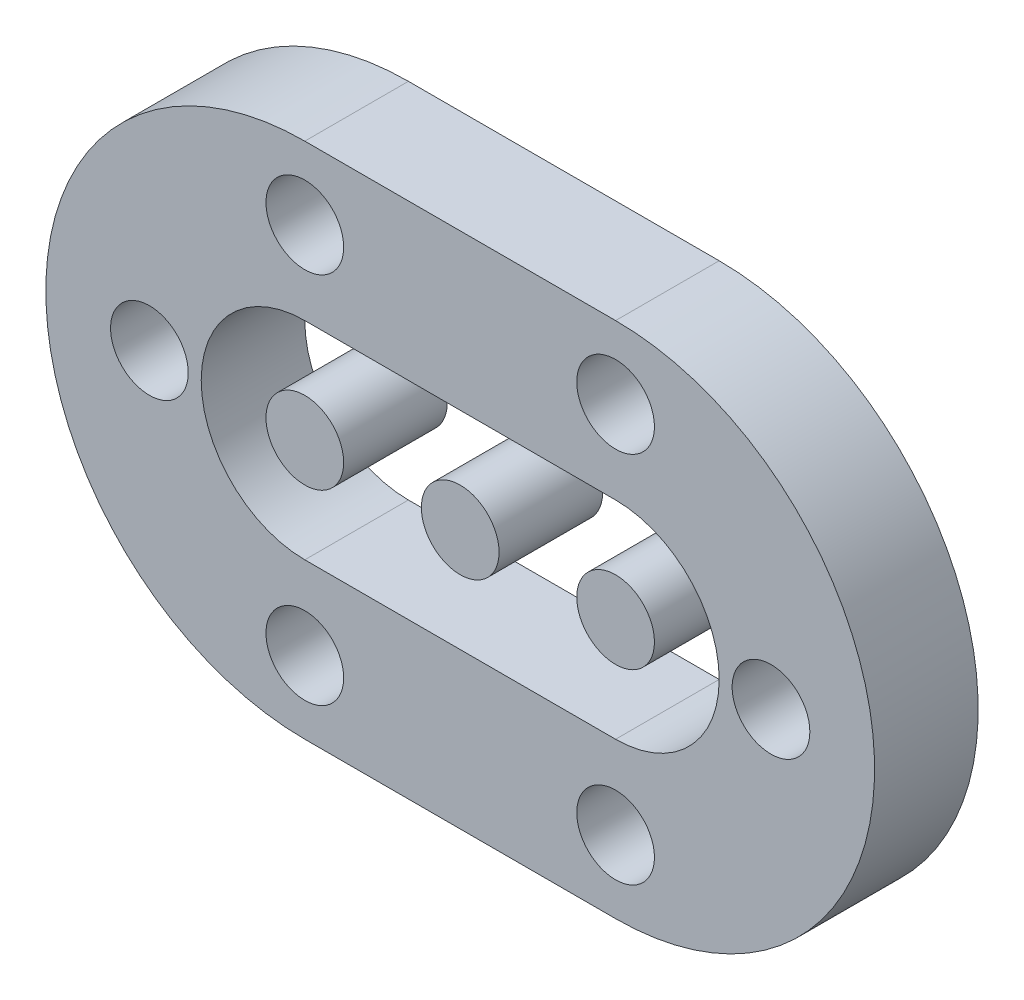
from build123d import *

# Parameters (mm, degrees)
CROQUIS1_R                = 3.75
SALIENTE_EXTRUIR1_DEPTH   = 10
SALIENTE_EXTRUIR1_2_DEPTH = 10
SALIENTE_EXTRUIR1_3_DEPTH = 10
SALIENTE_EXTRUIR1_4_DEPTH = 10


with BuildPart() as part:
    # Croquis1 → Saliente-Extruir1 (new body)
    with BuildSketch(Plane.XY):
        with BuildLine():
            Line((0, -25), (-30, -25))
            ThreePointArc((-30, -25), (-55, 0), (-30, 25))
            Line((-30, 25), (0, 25))
            ThreePointArc((0, 25), (25, 0), (0, -25))
        make_face()
        with Locations((0, -18)):
            Circle(CROQUIS1_R, mode=Mode.SUBTRACT)
        with Locations((-30, -18)):
            Circle(CROQUIS1_R, mode=Mode.SUBTRACT)
        with Locations((0, 18)):
            Circle(CROQUIS1_R, mode=Mode.SUBTRACT)
        with Locations((-30, 18)):
            Circle(CROQUIS1_R, mode=Mode.SUBTRACT)
        with Locations((15, 0)):
            Circle(CROQUIS1_R, mode=Mode.SUBTRACT)
        with Locations((-45, 0)):
            Circle(CROQUIS1_R, mode=Mode.SUBTRACT)
        with BuildLine():
            ThreePointArc((-30, 10), (-40, 0), (-30, -10))
            Line((-30, -10), (0, -10))
            ThreePointArc((0, -10), (10, 0), (0, 10))
            Line((0, 10), (-30, 10))
        make_face(mode=Mode.SUBTRACT)
    extrude(amount=SALIENTE_EXTRUIR1_DEPTH)


with BuildPart() as body_2:
    # Croquis1 → Saliente-Extruir1 2 (new body)
    with BuildSketch(Plane.XY):
        with Locations((-30, 0)):
            Circle(CROQUIS1_R)
    extrude(amount=SALIENTE_EXTRUIR1_2_DEPTH)


with BuildPart() as body_3:
    # Croquis1 → Saliente-Extruir1 3 (new body)
    with BuildSketch(Plane.XY):
        Circle(CROQUIS1_R)
    extrude(amount=SALIENTE_EXTRUIR1_3_DEPTH)


with BuildPart() as body_4:
    # Croquis1 → Saliente-Extruir1 4 (new body)
    with BuildSketch(Plane.XY):
        with Locations((-15, 0)):
            Circle(CROQUIS1_R)
    extrude(amount=SALIENTE_EXTRUIR1_4_DEPTH)


solid = Compound([part.part, body_2.part, body_3.part, body_4.part])
